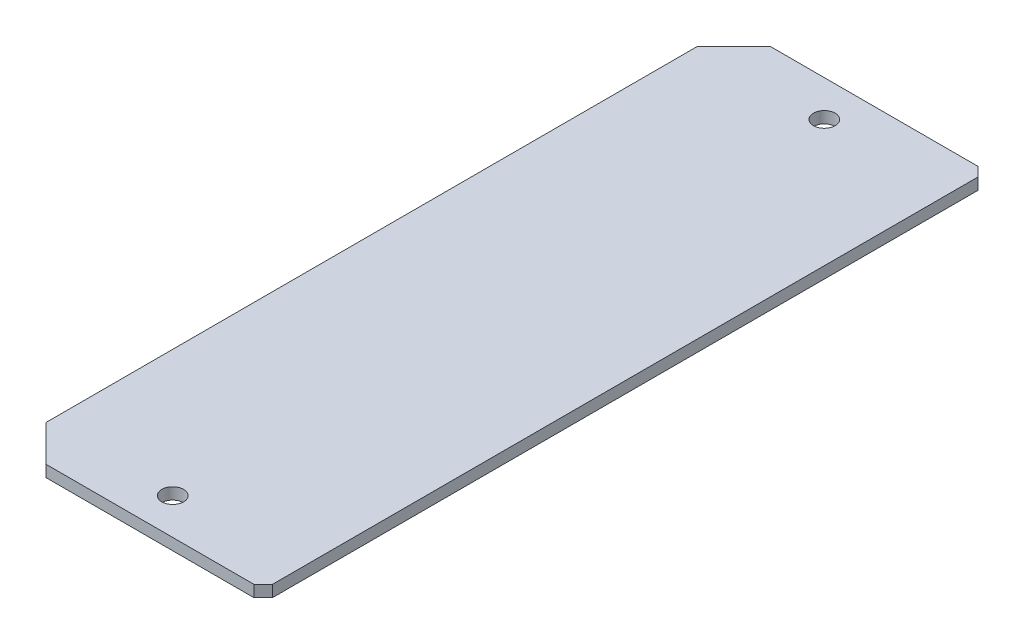
from build123d import *

# Parameters (mm, degrees)
SKETCH1_W           = 35
SKETCH1_H           = 100
BOSS_EXTRUDE1_DEPTH = 1.6
CHAMFER1_SIZE       = 5
CHAMFER2_SIZE       = 1.27
SKETCH2_R           = 1.5
CUT_EXTRUDE1_DEPTH  = 10


with BuildPart() as part:
    # Sketch1 → Boss-Extrude1 (new body)
    with BuildSketch(Plane(origin=(0, 0, 0), x_dir=(1, 0, 0), z_dir=(0, 1, 0))):
        Rectangle(SKETCH1_W, SKETCH1_H)
    extrude(amount=BOSS_EXTRUDE1_DEPTH)

    # Chamfer1
    chamfer1_edges = [part.edges().sort_by_distance(p)[0] for p in [
        (-17.5, 0.8, 50),
        (-17.5, 0.8, -50),
    ]]
    chamfer(chamfer1_edges, length=CHAMFER1_SIZE)

    # Chamfer2
    chamfer2_edges = [part.edges().sort_by_distance(p)[0] for p in [
        (17.5, 0.8, 50),
        (17.5, 0.8, -50),
    ]]
    chamfer(chamfer2_edges, length=CHAMFER2_SIZE)

    # Sketch2 → Cut-Extrude1 (cut)
    with BuildSketch(Plane(origin=(0, 1.6, 0), x_dir=(-1, 0, 0), z_dir=(0, 1, 0))):
        with Locations(Location((0, -45, 0), (0, 0, 90))):
            Circle(SKETCH2_R)
        with Locations(Location((0, 45, 0), (0, 0, 90))):
            Circle(SKETCH2_R)
    extrude(amount=-CUT_EXTRUDE1_DEPTH, mode=Mode.SUBTRACT)


solid = part.part
